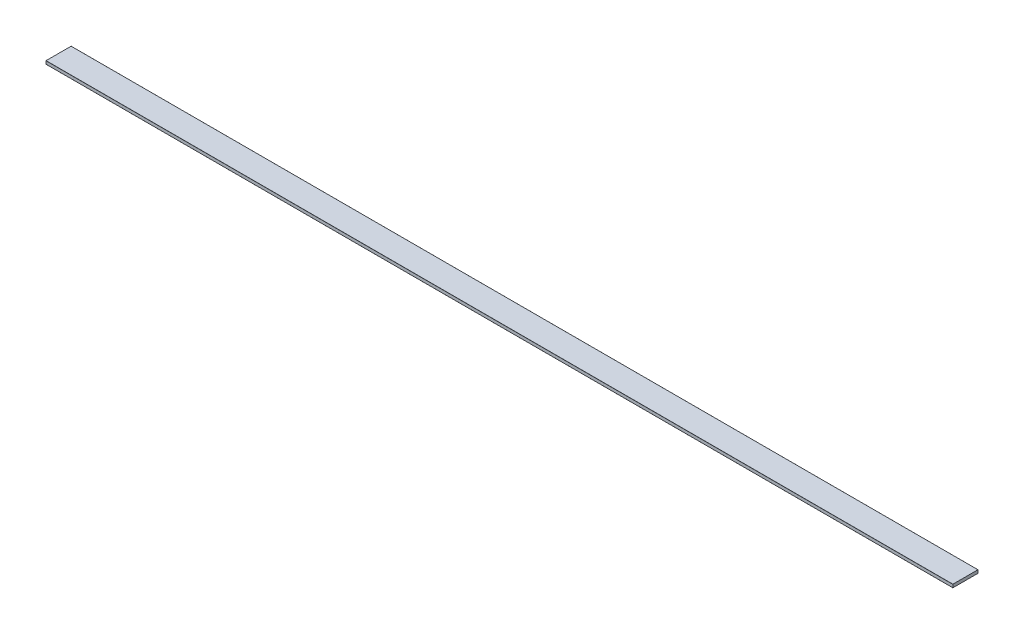
from build123d import *

# Parameters (mm, degrees)
BOSS_EXTRUDE1_DEPTH      = 1.5875
BOSS_EXTRUDE1_DEPTH_BACK = 1.5875
SKETCH3_W                = 914.4
SKETCH3_H                = 25.4
FILLET1_R                = 0.104775


with BuildPart() as part:
    # Sketch3 → Boss-Extrude1 (new, two sides: drawn at the far end of the back side and taken through both)
    with BuildSketch(Plane(origin=(0, 0, 0), x_dir=(1, 0, 0), z_dir=(0, 1, 0)).offset(-BOSS_EXTRUDE1_DEPTH_BACK)):
        Rectangle(SKETCH3_W, SKETCH3_H)
    extrude(amount=BOSS_EXTRUDE1_DEPTH + BOSS_EXTRUDE1_DEPTH_BACK)

    # Fillet1
    fillet1_edges = [part.edges().sort_by_distance(p)[0] for p in [
        (0, 1.5875, 12.7),
        (0, -1.5875, -12.7),
        (0, 1.5875, -12.7),
        (0, -1.5875, 12.7),
    ]]
    fillet(fillet1_edges, radius=FILLET1_R)


solid = part.part
